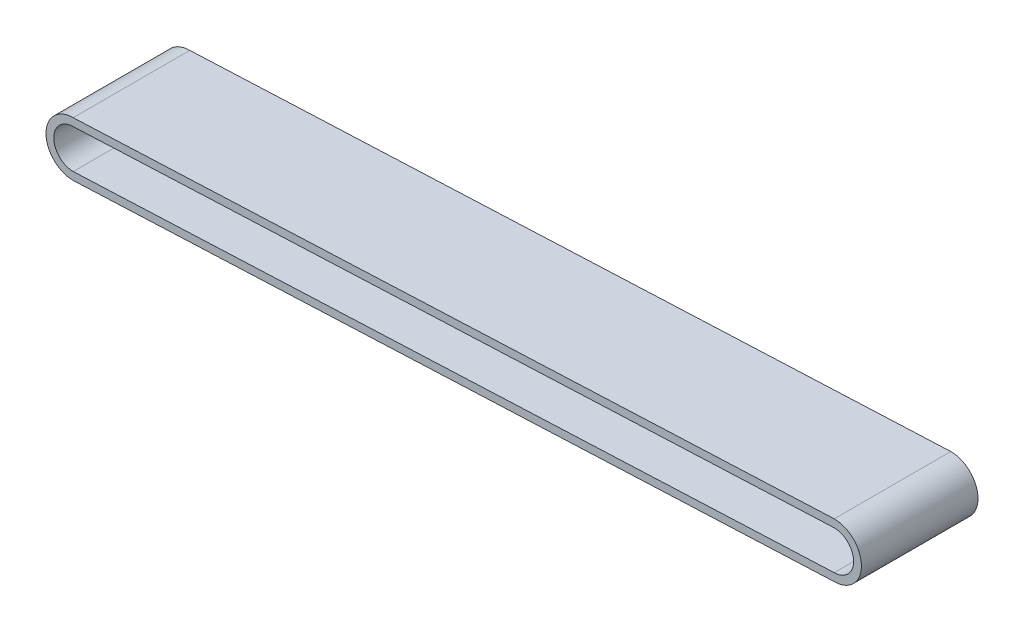
from build123d import *

# Parameters (mm, degrees)
BOSS_EXTRUDE1_DEPTH = 75


with BuildPart() as part:
    # Sketch1 → Boss-Extrude1 (new body)
    with BuildSketch(Plane.XY):
        with BuildLine():
            Line((-230, -37.5), (259.754203513, -16.197179228))
            ThreePointArc((259.754203513, -16.197179228), (277.036430442, 1.410189691), (259.536768159, 18.801469916))
            Line((259.536768159, 18.801469916), (-230, -2.5))
            ThreePointArc((-230, -2.5), (-247.5, -20), (-230, -37.5))
        make_face()
        with BuildLine():
            ThreePointArc((259.536768159, -11.198530084), (272.036768159, 1.301469916), (259.536768159, 13.801469916))
            Line((259.536768159, 13.801469916), (-230, -7.5))
            ThreePointArc((-230, -7.5), (-242.5, -20), (-230, -32.5))
            Line((-230, -32.5), (259.536768159, -11.198530084))
        make_face(mode=Mode.SUBTRACT)
    extrude(amount=BOSS_EXTRUDE1_DEPTH)


solid = part.part
